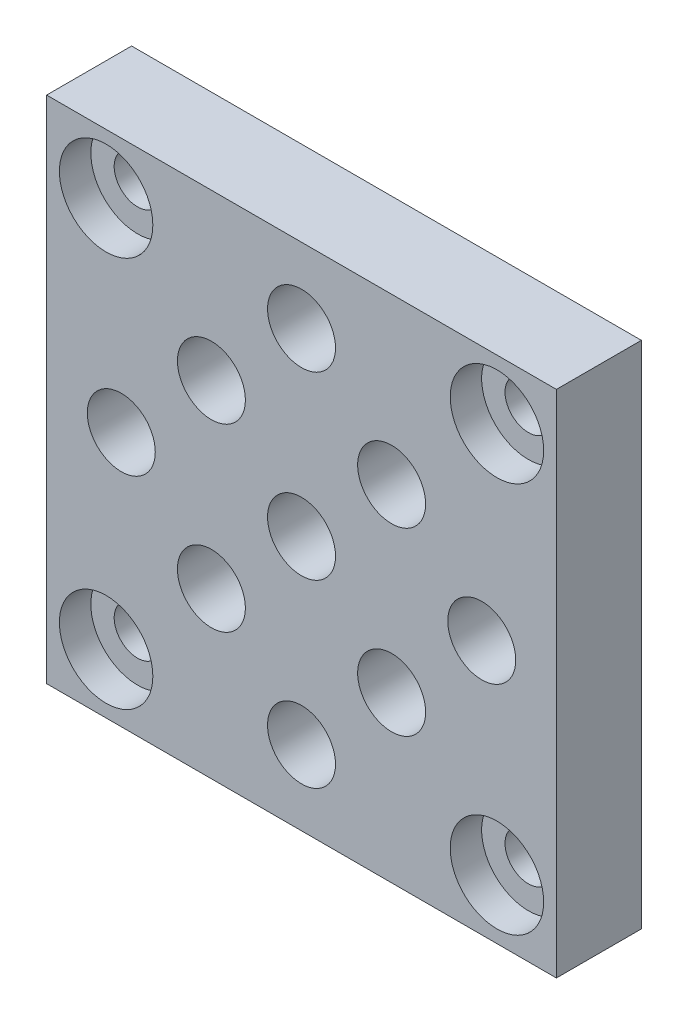
from build123d import *

# Parameters (mm, degrees)
SKETCH1_W                                = 60
SKETCH1_H                                = 60
BOSS_EXTRUDE1_DEPTH                      = 5
SKETCH2_R                                = 4
CUT_EXTRUDE1_DEPTH                       = 44.588989435
LPATTERN1_COUNT                          = 3
LPATTERN1_PITCH                          = 15
LPATTERN1_COUNT_DIR2                     = 3
LPATTERN1_PITCH_DIR2                     = 15
CBORE_FOR_M5_PAN_HEAD_SCREW1_D           = 5.5
CBORE_FOR_M5_PAN_HEAD_SCREW1_CBORE_D     = 11
CBORE_FOR_M5_PAN_HEAD_SCREW1_CBORE_DEPTH = 3.7


with BuildPart() as part:
    # Sketch1 → Boss-Extrude1 (new, symmetric)
    with BuildSketch(Plane(origin=(0, 0, 0), x_dir=(0, 1, 0), z_dir=(0, 0, 1))):
        Rectangle(SKETCH1_W, SKETCH1_H)
    extrude(amount=BOSS_EXTRUDE1_DEPTH, both=True)

    # Sketch2 → Cut-Extrude1 (cut, through all)
    with BuildSketch(Plane.XY.offset(5)):
        with Locations((0, -21.213203436)):
            Circle(SKETCH2_R)
    cut_extrude1 = extrude(amount=-CUT_EXTRUDE1_DEPTH, mode=Mode.SUBTRACT)

    # LPattern1: Cut-Extrude1 3 × 3
    with Locations(*[Vector(0.7071067811865476, 0.7071067811865476, 0) * (i * LPATTERN1_PITCH) + Vector(-0.7071067811865476, 0.7071067811865476, 0) * (j * LPATTERN1_PITCH_DIR2) for i in range(LPATTERN1_COUNT) for j in range(LPATTERN1_COUNT_DIR2) if (i, j) != (0, 0)]):
        add(cut_extrude1, mode=Mode.SUBTRACT)

    # CBORE for M5 Pan Head Screw1 (through all)
    with Locations(Plane(origin=(-23, 23, 5), x_dir=(1, 0, 0), z_dir=(0, 0, 1))):
        with Locations((0, 0), (46, 0), (46, -46), (0, -46)):
            CounterBoreHole(CBORE_FOR_M5_PAN_HEAD_SCREW1_D / 2, CBORE_FOR_M5_PAN_HEAD_SCREW1_CBORE_D / 2, CBORE_FOR_M5_PAN_HEAD_SCREW1_CBORE_DEPTH)


solid = part.part
